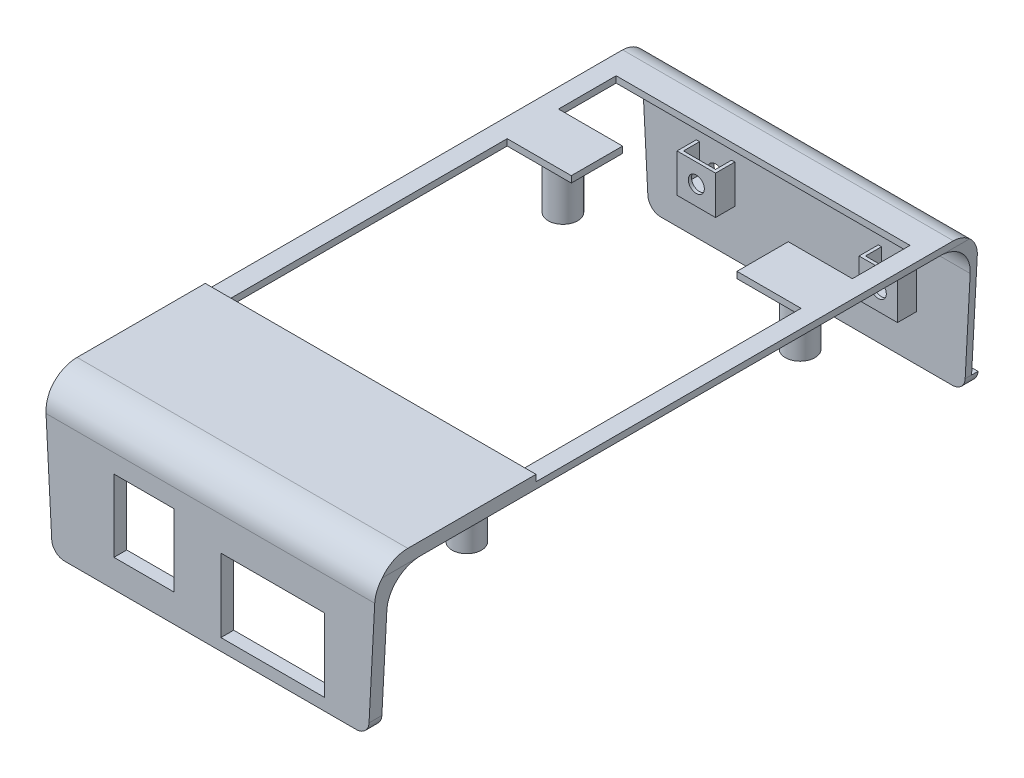
from build123d import *

# Parameters (mm, degrees)
BOSS_EXTRUDE1_DEPTH      = 25.8
BOSS_EXTRUDE1_DEPTH_BACK = 25.8
CUT_EXTRUDE2_DEPTH       = 105.5
FILLET3_R                = 2
FILLET2_R                = 5
SKETCH4_R                = 2.3
BOSS_EXTRUDE2_DEPTH      = 9
SKETCH8_W                = 9.403990972
SKETCH8_H                = 11.260041821
SKETCH8_W_2              = 16.148154032
SKETCH8_H_2              = 11.415373045
CUT_EXTRUDE5_DEPTH       = 10
CUT_EXTRUDE6_DEPTH       = 56
CUT_EXTRUDE7_DEPTH       = 56
SKETCH11_W               = 6
SKETCH11_H               = 6
BOSS_EXTRUDE3_DEPTH      = 4
SKETCH12_R               = 1.25
CUT_EXTRUDE8_DEPTH       = 7
SKETCH13_W               = 5
SKETCH13_H               = 2.5
CUT_EXTRUDE9_DEPTH       = 4.5


with BuildPart() as part:
    # Sketch1 → Boss-Extrude1 (new, two sides: drawn at the far end of the back side and taken through both)
    with BuildSketch(Plane(origin=(0, 0, 0), x_dir=(0, 0, -1), z_dir=(1, 0, 0)).offset(-BOSS_EXTRUDE1_DEPTH_BACK)):
        Polygon((-45.5, 0), (-45.5, 21.5), (45.5, 21.5), (45.5, 0), (47.5, 0), (47.5, 23.5), (-47.5, 23.5), (-47.5, 0), align=None)
    extrude(amount=BOSS_EXTRUDE1_DEPTH + BOSS_EXTRUDE1_DEPTH_BACK)

    # Sketch3 → Cut-Extrude2 (cut)
    with BuildSketch(Plane(origin=(0, 0, -47.5), x_dir=(-1, 0, 0), z_dir=(0, 0, -1))):
        Polygon((-25.8, 21.5), (-24.65, 0), (-25.8, 0), align=None)
        Polygon((25.8, 21.5), (24.65, 0), (25.8, 0), align=None)
    extrude(amount=-CUT_EXTRUDE2_DEPTH, mode=Mode.SUBTRACT)

    # Fillet3
    fillet3_edges = [part.edges().sort_by_distance(p)[0] for p in [
        (-24.65, 0, -46.5),
        (-24.65, 0, 46.5),
        (24.65, 0, 46.5),
        (24.65, 0, -46.5),
    ]]
    fillet(fillet3_edges, radius=FILLET3_R)

    # Fillet2
    fillet2_edges = [part.edges().sort_by_distance(p)[0] for p in [
        (0, 21.5, 45.5),
        (0, 23.5, 47.5),
        (0, 23.5, -47.5),
        (0, 21.5, -45.5),
    ]]
    fillet(fillet2_edges, radius=FILLET2_R)

    # Sketch4 → Boss-Extrude2 (add)
    with BuildSketch(Plane.XZ.offset(-21.5)):
        with Locations((-18.5, -26)):
            Circle(SKETCH4_R)
        with Locations((18.5, -26)):
            Circle(SKETCH4_R)
        with Locations((-18.5, 26)):
            Circle(SKETCH4_R)
        with Locations((18.5, 26)):
            Circle(SKETCH4_R)
    extrude(amount=BOSS_EXTRUDE2_DEPTH)

    # Sketch8 → Cut-Extrude5 (cut)
    with BuildSketch(Plane.XY.offset(47.5)):
        with Locations((-10.345619811, 9.988318774)):
            Rectangle(SKETCH8_W, SKETCH8_H)
        with Locations((9.712305605, 7.570757784)):
            Rectangle(SKETCH8_W_2, SKETCH8_H_2)
    extrude(amount=-CUT_EXTRUDE5_DEPTH, mode=Mode.SUBTRACT)

    # Sketch9 → Cut-Extrude6 (cut)
    with BuildSketch(Plane(origin=(25.8, 0, 0), x_dir=(0, 0, -1), z_dir=(1, 0, 0))):
        with BuildLine():
            Line((-22.5, 23.5), (-22.5, 22.498632165))
            Line((-22.5, 22.498632165), (42.604598318, 22.498632165))
            ThreePointArc((42.604598318, 22.498632165), (45.365169565, 21.291201061), (46.5, 18.5))
            Line((46.5, 18.5), (46.5, 1.893175959))
            Line((46.5, 1.893175959), (47.5, 1.893175959))
            Line((47.5, 1.893175959), (47.5, 18.5))
            ThreePointArc((47.5, 18.5), (46.035533906, 22.035533906), (42.5, 23.5))
            Line((42.5, 23.5), (-22.5, 23.5))
        make_face()
    extrude(amount=-CUT_EXTRUDE6_DEPTH, mode=Mode.SUBTRACT)

    # Sketch10 → Cut-Extrude7 (cut)
    with BuildSketch(Plane(origin=(0, 22.498632165, 0), x_dir=(1, 0, 0), z_dir=(0, 1, 0))):
        Polygon((-22.8, -22.5), (-22.8, 21.604598318), (-12.8, 21.604598318), (-12.8, 29.604598318), (-22.8, 29.604598318), (-22.8, 38.604598318), (23.045882962, 38.604598318), (23.045882962, 29.604598318), (13.045882962, 29.604598318), (13.045882962, 21.604598318), (23.045882962, 21.604598318), (23.045882962, -22.5), align=None)
    extrude(amount=-CUT_EXTRUDE7_DEPTH, mode=Mode.SUBTRACT)

    # Sketch11 → Boss-Extrude3 (add)
    with BuildSketch(Plane(origin=(0, 0, -46.5), x_dir=(-1, 0, 0), z_dir=(0, 0, -1))):
        with Locations((-14.195398892, 10.196587979)):
            Rectangle(SKETCH11_W, SKETCH11_H)
        with Locations((14.195398892, 10.196587979)):
            Rectangle(SKETCH11_W, SKETCH11_H)
    extrude(amount=-BOSS_EXTRUDE3_DEPTH)

    # Sketch12 → Cut-Extrude8 (cut)
    with BuildSketch(Plane(origin=(0, 0, -46.5), x_dir=(-1, 0, 0), z_dir=(0, 0, -1))):
        with Locations((14.195398892, 10.196587979)):
            Circle(SKETCH12_R)
        with Locations((-14.195398892, 10.196587979)):
            Circle(SKETCH12_R)
    extrude(amount=-CUT_EXTRUDE8_DEPTH, mode=Mode.SUBTRACT)

    # Sketch13 → Cut-Extrude9 (cut)
    with BuildSketch(Plane(origin=(0, 13.196587979, 0), x_dir=(1, 0, 0), z_dir=(0, 1, 0))):
        with Locations((14.195398892, 44.25)):
            Rectangle(SKETCH13_W, SKETCH13_H)
        with Locations((-14.195398892, 44.25)):
            Rectangle(SKETCH13_W, SKETCH13_H)
    extrude(amount=-CUT_EXTRUDE9_DEPTH, mode=Mode.SUBTRACT)


solid = part.part
